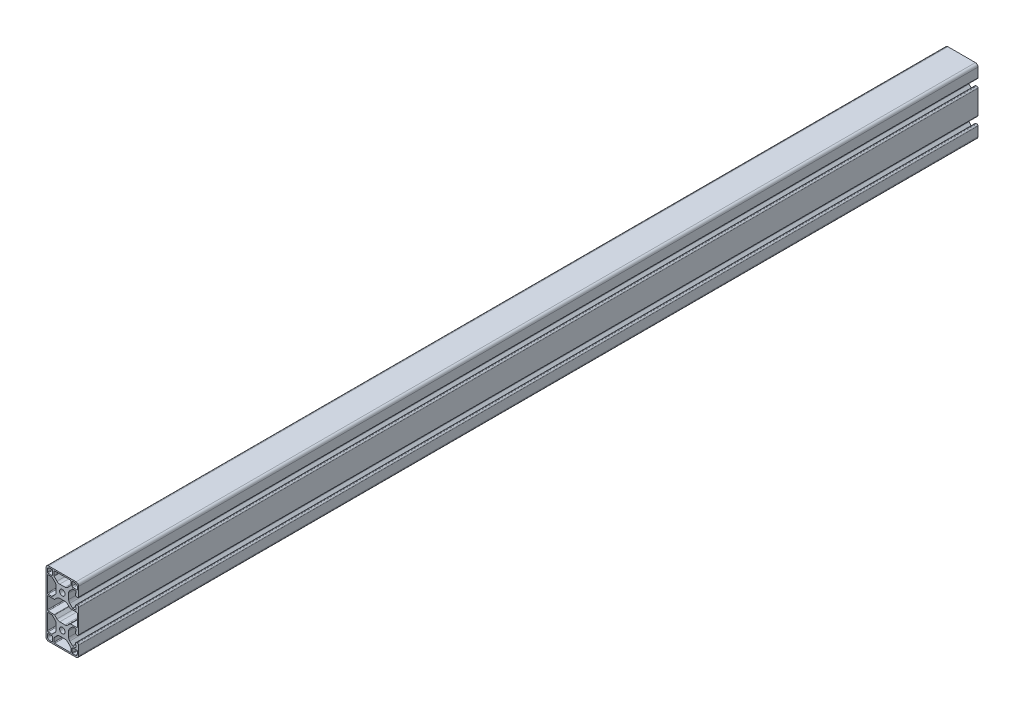
from build123d import *

# Parameters (mm, degrees)
SKETCH1_R           = 3.405
BOSS_EXTRUDE1_DEPTH = 1100


with BuildPart() as part:
    # Sketch1 → Boss-Extrude1 (new body)
    with BuildSketch(Plane(origin=(0, 0, -4000), x_dir=(-1, 0, 0), z_dir=(0, 0, -1))):
        with BuildLine():
            Line((20, -16.83), (20, 56.83))
            ThreePointArc((20, 56.83), (19.071528496, 59.071528496), (16.83, 60))
            Line((16.83, 60), (-16.83, 60))
            ThreePointArc((-16.83, 60), (-19.071528496, 59.071528496), (-20, 56.83))
            Line((-20, 56.83), (-20, 45.54033026))
            ThreePointArc((-20, 45.54033026), (-19.566421305, 44.493578695), (-18.51966974, 44.06))
            Line((-18.51966974, 44.06), (-17.80484913, 44.06))
            ThreePointArc((-17.80484913, 44.06), (-16.486201664, 44.606201664), (-15.94, 45.92484913))
            Line((-15.94, 45.92484913), (-15.94, 47.28072692))
            Line((-15.94, 47.28072692), (-16.7, 47.28072692))
            Line((-16.7, 47.28072692), (-16.7, 48.94832744))
            ThreePointArc((-16.7, 48.94832744), (-16.308497671, 49.893497671), (-15.36332744, 50.285))
            Line((-15.36332744, 50.285), (-12.987102448, 50.285))
            ThreePointArc((-12.987102448, 50.285), (-12.646514194, 50.217252784), (-12.357777413, 50.024325035))
            Line((-12.357777413, 50.024325035), (-9.091242789, 46.757790411))
            ThreePointArc((-9.091242789, 46.757790411), (-8.061572221, 45.216779505), (-7.7, 43.399033201))
            Line((-7.7, 43.399033201), (-7.7, 36.600966799))
            ThreePointArc((-7.7, 36.600966799), (-8.061572221, 34.783220495), (-9.091242789, 33.242209589))
            Line((-9.091242789, 33.242209589), (-12.357777413, 29.975674965))
            ThreePointArc((-12.357777413, 29.975674965), (-12.646514194, 29.782747216), (-12.987102448, 29.715))
            Line((-12.987102448, 29.715), (-15.36332744, 29.715))
            ThreePointArc((-15.36332744, 29.715), (-16.308497671, 30.106502329), (-16.7, 31.05167256))
            Line((-16.7, 31.05167256), (-16.7, 32.71927308))
            Line((-16.7, 32.71927308), (-15.94, 32.71927308))
            Line((-15.94, 32.71927308), (-15.94, 34.07515087))
            ThreePointArc((-15.94, 34.07515087), (-16.486201664, 35.393798336), (-17.80484913, 35.94))
            Line((-17.80484913, 35.94), (-18.51966974, 35.94))
            ThreePointArc((-18.51966974, 35.94), (-19.566421305, 35.506421305), (-20, 34.45966974))
            Line((-20, 34.45966974), (-20, 5.54033026))
            ThreePointArc((-20, 5.54033026), (-19.566421305, 4.493578695), (-18.51966974, 4.06))
            Line((-18.51966974, 4.06), (-17.80484913, 4.06))
            ThreePointArc((-17.80484913, 4.06), (-16.486201664, 4.606201664), (-15.94, 5.92484913))
            Line((-15.94, 5.92484913), (-15.94, 7.28072692))
            Line((-15.94, 7.28072692), (-16.7, 7.28072692))
            Line((-16.7, 7.28072692), (-16.7, 9.015))
            ThreePointArc((-16.7, 9.015), (-16.328025612, 9.913025612), (-15.43, 10.285))
            Line((-15.43, 10.285), (-12.987102448, 10.285))
            ThreePointArc((-12.987102448, 10.285), (-12.646514194, 10.217252784), (-12.357777413, 10.024325035))
            Line((-12.357777413, 10.024325035), (-9.091242789, 6.757790411))
            ThreePointArc((-9.091242789, 6.757790411), (-8.061572221, 5.216779505), (-7.7, 3.399033201))
            Line((-7.7, 3.399033201), (-7.7, -3.399033201))
            ThreePointArc((-7.7, -3.399033201), (-8.061572221, -5.216779505), (-9.091242789, -6.757790411))
            Line((-9.091242789, -6.757790411), (-12.357777413, -10.024325035))
            ThreePointArc((-12.357777413, -10.024325035), (-12.646514194, -10.217252784), (-12.987102448, -10.285))
            Line((-12.987102448, -10.285), (-15.36332744, -10.285))
            ThreePointArc((-15.36332744, -10.285), (-16.308497671, -9.893497671), (-16.7, -8.94832744))
            Line((-16.7, -8.94832744), (-16.7, -7.28072692))
            Line((-16.7, -7.28072692), (-15.94, -7.28072692))
            Line((-15.94, -7.28072692), (-15.94, -5.92484913))
            ThreePointArc((-15.94, -5.92484913), (-16.486201664, -4.606201664), (-17.80484913, -4.06))
            Line((-17.80484913, -4.06), (-18.51966974, -4.06))
            ThreePointArc((-18.51966974, -4.06), (-19.566421305, -4.493578695), (-20, -5.54033026))
            Line((-20, -5.54033026), (-20, -16.83))
            ThreePointArc((-20, -16.83), (-19.071528496, -19.071528496), (-16.83, -20))
            Line((-16.83, -20), (16.83, -20))
            ThreePointArc((16.83, -20), (19.071528496, -19.071528496), (20, -16.83))
        make_face()
        with Locations(Location((0, 40, 0), (0, 0, 180))):
            Circle(SKETCH1_R, mode=Mode.SUBTRACT)
        with Locations(Location((0, 0, 0), (0, 0, 180))):
            Circle(SKETCH1_R, mode=Mode.SUBTRACT)
        with BuildLine():
            Line((18.3499228, 55.5500772), (18.3499228, 52.5700772))
            ThreePointArc((18.3499228, 52.5700772), (18.165400072, 52.124599928), (17.7199228, 51.9400772))
            Line((17.7199228, 51.9400772), (13.2099228, 51.9400772))
            ThreePointArc((13.2099228, 51.9400772), (12.311897188, 52.312051588), (11.9399228, 53.2100772))
            Line((11.9399228, 53.2100772), (11.9399228, 57.7200772))
            ThreePointArc((11.9399228, 57.7200772), (12.124445528, 58.165554472), (12.5699228, 58.3500772))
            Line((12.5699228, 58.3500772), (15.5499228, 58.3500772))
            ThreePointArc((15.5499228, 58.3500772), (17.529821787, 57.529976187), (18.3499228, 55.5500772))
        make_face(mode=Mode.SUBTRACT)
        with BuildLine():
            Line((18.3499228, -12.5700772), (18.3499228, -15.5500772))
            ThreePointArc((18.3499228, -15.5500772), (17.529821787, -17.529976187), (15.5499228, -18.3500772))
            Line((15.5499228, -18.3500772), (12.5699228, -18.3500772))
            ThreePointArc((12.5699228, -18.3500772), (12.124445528, -18.165554472), (11.9399228, -17.7200772))
            Line((11.9399228, -17.7200772), (11.9399228, -13.2100772))
            ThreePointArc((11.9399228, -13.2100772), (12.311897188, -12.312051588), (13.2099228, -11.9400772))
            Line((13.2099228, -11.9400772), (17.7199228, -11.9400772))
            ThreePointArc((17.7199228, -11.9400772), (18.165400072, -12.124599928), (18.3499228, -12.5700772))
        make_face(mode=Mode.SUBTRACT)
        with BuildLine():
            Line((18.34920635, 27.17611111), (18.34920635, 12.82388889))
            ThreePointArc((18.34920635, 12.82388889), (18.088856822, 12.195349528), (17.46031746, 11.935))
            Line((17.46031746, 11.935), (9.970197693, 11.935))
            ThreePointArc((9.970197693, 11.935), (9.629609438, 11.867252784), (9.340872657, 11.674325035))
            Line((9.340872657, 11.674325035), (6.581173831, 8.914626209))
            ThreePointArc((6.581173831, 8.914626209), (5.040162925, 7.884955641), (3.222416621, 7.52338342))
            Line((3.222416621, 7.52338342), (-3.222416621, 7.52338342))
            ThreePointArc((-3.222416621, 7.52338342), (-5.040162925, 7.884955641), (-6.581173831, 8.914626209))
            Line((-6.581173831, 8.914626209), (-9.340872657, 11.674325035))
            ThreePointArc((-9.340872657, 11.674325035), (-9.629609438, 11.867252784), (-9.970197693, 11.935))
            Line((-9.970197693, 11.935), (-17.46031746, 11.935))
            ThreePointArc((-17.46031746, 11.935), (-18.088856822, 12.195349528), (-18.34920635, 12.82388889))
            Line((-18.34920635, 12.82388889), (-18.34920635, 27.17611111))
            ThreePointArc((-18.34920635, 27.17611111), (-18.088856822, 27.804650472), (-17.46031746, 28.065))
            Line((-17.46031746, 28.065), (-9.970197693, 28.065))
            ThreePointArc((-9.970197693, 28.065), (-9.629609438, 28.132747216), (-9.340872657, 28.325674965))
            Line((-9.340872657, 28.325674965), (-6.581173831, 31.085373791))
            ThreePointArc((-6.581173831, 31.085373791), (-5.040162925, 32.115044359), (-3.222416621, 32.47661658))
            Line((-3.222416621, 32.47661658), (3.222416621, 32.47661658))
            ThreePointArc((3.222416621, 32.47661658), (5.040162925, 32.115044359), (6.581173831, 31.085373791))
            Line((6.581173831, 31.085373791), (9.340872657, 28.325674965))
            ThreePointArc((9.340872657, 28.325674965), (9.629609438, 28.132747216), (9.970197693, 28.065))
            Line((9.970197693, 28.065), (17.46031746, 28.065))
            ThreePointArc((17.46031746, 28.065), (18.088856822, 27.804650472), (18.34920635, 27.17611111))
        make_face(mode=Mode.SUBTRACT)
        with BuildLine():
            Line((18.34920635, 9.39611111), (18.34920635, -9.39611111))
            ThreePointArc((18.34920635, -9.39611111), (18.088856822, -10.024650472), (17.46031746, -10.285))
            Line((17.46031746, -10.285), (12.987102448, -10.285))
            ThreePointArc((12.987102448, -10.285), (12.646514194, -10.217252784), (12.357777413, -10.024325035))
            Line((12.357777413, -10.024325035), (9.091242789, -6.757790411))
            ThreePointArc((9.091242789, -6.757790411), (8.061572221, -5.216779505), (7.7, -3.399033201))
            Line((7.7, -3.399033201), (7.7, 3.399033201))
            ThreePointArc((7.7, 3.399033201), (8.061572221, 5.216779505), (9.091242789, 6.757790411))
            Line((9.091242789, 6.757790411), (12.357777413, 10.024325035))
            ThreePointArc((12.357777413, 10.024325035), (12.646514194, 10.217252784), (12.987102448, 10.285))
            Line((12.987102448, 10.285), (17.46031746, 10.285))
            ThreePointArc((17.46031746, 10.285), (18.088856822, 10.024650472), (18.34920635, 9.39611111))
        make_face(mode=Mode.SUBTRACT)
        with BuildLine():
            Line((18.34920635, 49.39611111), (18.34920635, 30.60388889))
            ThreePointArc((18.34920635, 30.60388889), (18.088856822, 29.975349528), (17.46031746, 29.715))
            Line((17.46031746, 29.715), (12.987102448, 29.715))
            ThreePointArc((12.987102448, 29.715), (12.646514194, 29.782747216), (12.357777413, 29.975674965))
            Line((12.357777413, 29.975674965), (9.091242789, 33.242209589))
            ThreePointArc((9.091242789, 33.242209589), (8.061572221, 34.783220495), (7.7, 36.600966799))
            Line((7.7, 36.600966799), (7.7, 43.399033201))
            ThreePointArc((7.7, 43.399033201), (8.061572221, 45.216779505), (9.091242789, 46.757790411))
            Line((9.091242789, 46.757790411), (12.357777413, 50.024325035))
            ThreePointArc((12.357777413, 50.024325035), (12.646514194, 50.217252784), (12.987102448, 50.285))
            Line((12.987102448, 50.285), (17.46031746, 50.285))
            ThreePointArc((17.46031746, 50.285), (18.088856822, 50.024650472), (18.34920635, 49.39611111))
        make_face(mode=Mode.SUBTRACT)
        with BuildLine():
            Line((10.2899228, 57.46118831), (10.2899228, 52.992025248))
            ThreePointArc((10.2899228, 52.992025248), (10.222175584, 52.651436994), (10.029247835, 52.362700213))
            Line((10.029247835, 52.362700213), (6.581173831, 48.914626209))
            ThreePointArc((6.581173831, 48.914626209), (5.040162925, 47.884955641), (3.222416621, 47.52338342))
            Line((3.222416621, 47.52338342), (-3.222416621, 47.52338342))
            ThreePointArc((-3.222416621, 47.52338342), (-5.040162925, 47.884955641), (-6.581173831, 48.914626209))
            Line((-6.581173831, 48.914626209), (-10.029247835, 52.362700213))
            ThreePointArc((-10.029247835, 52.362700213), (-10.222175584, 52.651436994), (-10.2899228, 52.992025248))
            Line((-10.2899228, 52.992025248), (-10.2899228, 57.46118831))
            ThreePointArc((-10.2899228, 57.46118831), (-10.029573272, 58.089727672), (-9.40103391, 58.3500772))
            Line((-9.40103391, 58.3500772), (9.40103391, 58.3500772))
            ThreePointArc((9.40103391, 58.3500772), (10.029573272, 58.089727672), (10.2899228, 57.46118831))
        make_face(mode=Mode.SUBTRACT)
        with BuildLine():
            Line((10.2899228, -12.992025248), (10.2899228, -17.42161897))
            ThreePointArc((10.2899228, -17.42161897), (10.029573272, -18.050158332), (9.40103391, -18.31050786))
            Line((9.40103391, -18.31050786), (-9.40103391, -18.31050786))
            ThreePointArc((-9.40103391, -18.31050786), (-10.029573272, -18.050158332), (-10.2899228, -17.42161897))
            Line((-10.2899228, -17.42161897), (-10.2899228, -12.992025248))
            ThreePointArc((-10.2899228, -12.992025248), (-10.222175584, -12.651436994), (-10.029247835, -12.362700213))
            Line((-10.029247835, -12.362700213), (-6.581173831, -8.914626209))
            ThreePointArc((-6.581173831, -8.914626209), (-5.040162925, -7.884955641), (-3.222416621, -7.52338342))
            Line((-3.222416621, -7.52338342), (3.222416621, -7.52338342))
            ThreePointArc((3.222416621, -7.52338342), (5.040162925, -7.884955641), (6.581173831, -8.914626209))
            Line((6.581173831, -8.914626209), (10.029247835, -12.362700213))
            ThreePointArc((10.029247835, -12.362700213), (10.222175584, -12.651436994), (10.2899228, -12.992025248))
        make_face(mode=Mode.SUBTRACT)
        with BuildLine():
            Line((-11.9399228, 57.7200772), (-11.9399228, 53.2100772))
            ThreePointArc((-11.9399228, 53.2100772), (-12.311897188, 52.312051588), (-13.2099228, 51.9400772))
            Line((-13.2099228, 51.9400772), (-17.7199228, 51.9400772))
            ThreePointArc((-17.7199228, 51.9400772), (-18.165400072, 52.124599928), (-18.3499228, 52.5700772))
            Line((-18.3499228, 52.5700772), (-18.3499228, 55.5500772))
            ThreePointArc((-18.3499228, 55.5500772), (-17.529821787, 57.529976187), (-15.5499228, 58.3500772))
            Line((-15.5499228, 58.3500772), (-12.5699228, 58.3500772))
            ThreePointArc((-12.5699228, 58.3500772), (-12.124445528, 58.165554472), (-11.9399228, 57.7200772))
        make_face(mode=Mode.SUBTRACT)
        with BuildLine():
            Line((-11.9399228, -13.2100772), (-11.9399228, -17.7200772))
            ThreePointArc((-11.9399228, -17.7200772), (-12.124445528, -18.165554472), (-12.5699228, -18.3500772))
            Line((-12.5699228, -18.3500772), (-15.5499228, -18.3500772))
            ThreePointArc((-15.5499228, -18.3500772), (-17.529821787, -17.529976187), (-18.3499228, -15.5500772))
            Line((-18.3499228, -15.5500772), (-18.3499228, -12.5700772))
            ThreePointArc((-18.3499228, -12.5700772), (-18.165400072, -12.124599928), (-17.7199228, -11.9400772))
            Line((-17.7199228, -11.9400772), (-13.2099228, -11.9400772))
            ThreePointArc((-13.2099228, -11.9400772), (-12.311897188, -12.312051588), (-11.9399228, -13.2100772))
        make_face(mode=Mode.SUBTRACT)
    extrude(amount=-BOSS_EXTRUDE1_DEPTH)


solid = part.part
